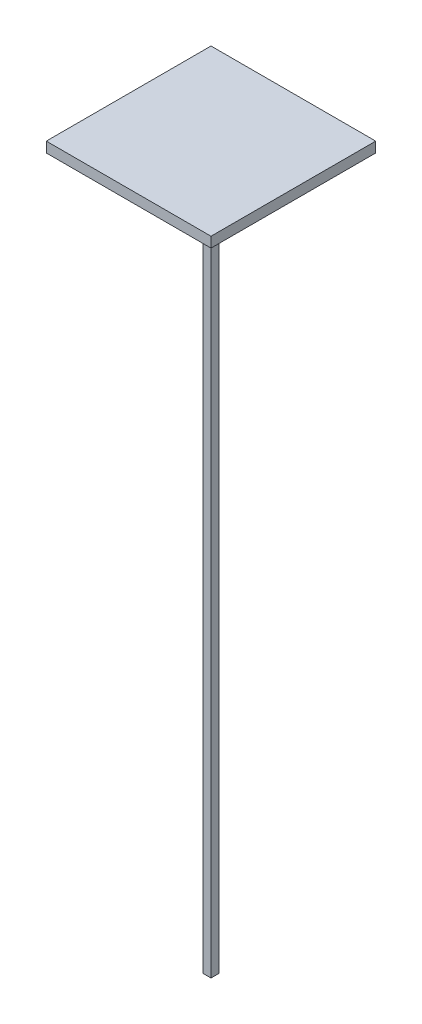
from build123d import *

# Parameters (mm, degrees)
ESQUISSE1_W      = 4
ESQUISSE1_H      = 4
EXTRUSION1_DEPTH = 345
ESQUISSE2_W      = 80
ESQUISSE2_H      = 80
EXTRUSION2_DEPTH = 5


with BuildPart() as part:
    # Esquisse1 → Extrusion1 (new body)
    with BuildSketch(Plane(origin=(0, 0, 0), x_dir=(1, 0, 0), z_dir=(0, 1, 0))):
        with Locations((2, 2)):
            Rectangle(ESQUISSE1_W, ESQUISSE1_H)
    extrude(amount=EXTRUSION1_DEPTH)

    # Esquisse2 → Extrusion2 (add)
    with BuildSketch(Plane(origin=(0, 345, 0), x_dir=(1, 0, 0), z_dir=(0, 1, 0))):
        with Locations((2, 2)):
            Rectangle(ESQUISSE2_W, ESQUISSE2_H)
    extrude(amount=EXTRUSION2_DEPTH)


solid = part.part
